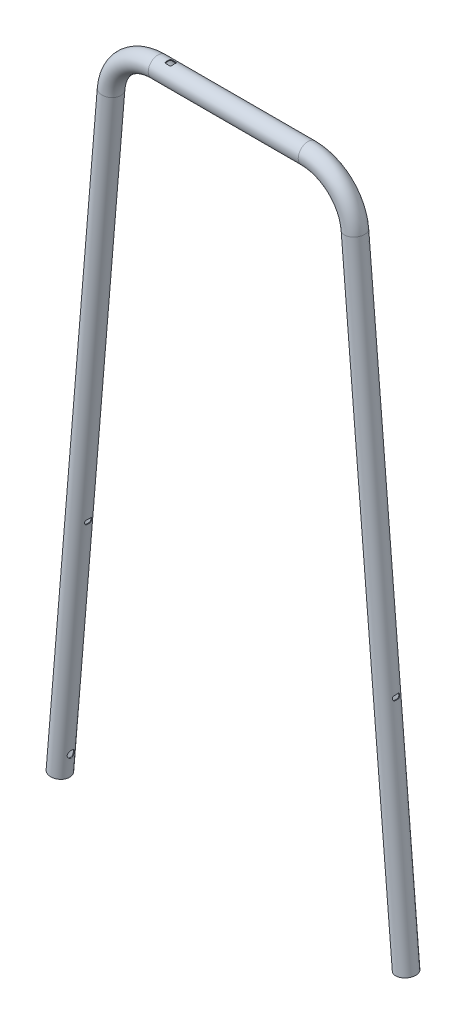
from build123d import *

# Parameters (mm, degrees)
SKETCH2_R           = 11
SKETCH2_R_2         = 10.2
SKETCH17_R          = 4
CUT_EXTRUDE6_DEPTH  = 50
CUT_EXTRUDE7_DEPTH  = 50
SKETCH19_R          = 4
CUT_EXTRUDE8_DEPTH  = 50
SKETCH20_R          = 3.5
CUT_EXTRUDE9_DEPTH  = 50
CUT_EXTRUDE10_DEPTH = 10


with BuildPart() as part:
    # Sweep2: sweep along a path in Sketch1
    with BuildLine(Plane.XY) as sweep2_path:
        Line((194.85, -162.284032228), (137.233830876, 531.10480277))
        ThreePointArc((137.233830876, 531.10480277), (120.307304917, 565.713456504), (84.415859244, 579.715967772))
        Line((84.415859244, 579.715967772), (-84.415859244, 579.715967772))
        ThreePointArc((-84.415859244, 579.715967772), (-120.307304917, 565.713456504), (-137.233830876, 531.10480277))
        Line((-137.233830876, 531.10480277), (-194.85, -162.284032228))
    # Sketch2 → Sweep2 (sweep)
    with BuildSketch(Plane(origin=(-194.85, -162.284032228, 0), x_dir=(-0.9965655024977618, 0.08280820751220104, 0), z_dir=(-0.08280820751220103, -0.9965655024977617, 0))):
        Circle(SKETCH2_R)
        Circle(SKETCH2_R_2, mode=Mode.SUBTRACT)
    sweep(path=sweep2_path.line)

    # Sketch17 → Cut-Extrude6 (cut)
    with BuildSketch(Plane(origin=(-194.85, -162.284032228, 0), x_dir=(0, 0, 1), z_dir=(-0.9965655024977617, 0.08280820751220212, 0))):
        with Locations((0, 23.8)):
            Circle(SKETCH17_R)
    cut_extrude6 = extrude(amount=-CUT_EXTRUDE6_DEPTH, mode=Mode.SUBTRACT)

    # Sketch18 → Cut-Extrude7 (cut, symmetric)
    with BuildSketch(Plane(origin=(-194.85, -162.284032228, 0), x_dir=(0, 0, 1), z_dir=(-0.9965655024977617, 0.08280820751220212, 0))):
        with BuildLine():
            Line((-2, 263.803489028), (2, 263.803489028))
            ThreePointArc((2, 263.803489028), (3.414213562, 263.21770259), (4, 261.803489028))
            Line((4, 261.803489028), (4, 260.803489028))
            ThreePointArc((4, 260.803489028), (3.414213562, 259.389275466), (2, 258.803489028))
            Line((2, 258.803489028), (-2, 258.803489028))
            ThreePointArc((-2, 258.803489028), (-3.414213562, 259.389275466), (-4, 260.803489028))
            Line((-4, 260.803489028), (-4, 261.803489028))
            ThreePointArc((-4, 261.803489028), (-3.414213562, 263.21770259), (-2, 263.803489028))
        make_face()
    cut_extrude7 = extrude(amount=CUT_EXTRUDE7_DEPTH, both=True, mode=Mode.SUBTRACT)

    # Mirror2: Cut-Extrude6, Cut-Extrude7 across plane
    add(cut_extrude6.mirror(Plane(origin=(0, 0, 0), x_dir=(0, 0, 1), z_dir=(1, 0, 0))), mode=Mode.SUBTRACT)
    add(cut_extrude7.mirror(Plane(origin=(0, 0, 0), x_dir=(0, 0, 1), z_dir=(1, 0, 0))), mode=Mode.SUBTRACT)

    # Sketch19 → Cut-Extrude8 (cut)
    with BuildSketch(Plane(origin=(-194.85, -162.284032228, 0), x_dir=(0, 0, 1), z_dir=(-0.9965655024977617, 0.08280820751220212, 0))):
        with Locations((0, 496.8)):
            Circle(SKETCH19_R)
    extrude(amount=CUT_EXTRUDE8_DEPTH, mode=Mode.SUBTRACT)

    # Sketch20 → Cut-Extrude9 (cut)
    with BuildSketch(Plane(origin=(0, 590.715967772, 0), x_dir=(1, 0, 0), z_dir=(0, 1, 0))):
        with Locations((-69.933830876, 0)):
            Circle(SKETCH20_R)
    extrude(amount=-CUT_EXTRUDE9_DEPTH, mode=Mode.SUBTRACT)

    # Sketch21 → Cut-Extrude10 (cut)
    with BuildSketch(Plane(origin=(0, 590.715967772, 0), x_dir=(1, 0, 0), z_dir=(0, 1, 0))):
        with BuildLine():
            Line((-72.433830876, -3.5), (-67.433830876, -3.5))
            ThreePointArc((-67.433830876, -3.5), (-66.726724095, -3.207106781), (-66.433830876, -2.5))
            Line((-66.433830876, -2.5), (-66.433830876, 2.5))
            ThreePointArc((-66.433830876, 2.5), (-66.726724095, 3.207106781), (-67.433830876, 3.5))
            Line((-67.433830876, 3.5), (-72.433830876, 3.5))
            ThreePointArc((-72.433830876, 3.5), (-73.140937657, 3.207106781), (-73.433830876, 2.5))
            Line((-73.433830876, 2.5), (-73.433830876, -2.5))
            ThreePointArc((-73.433830876, -2.5), (-73.140937657, -3.207106781), (-72.433830876, -3.5))
        make_face()
    extrude(amount=-CUT_EXTRUDE10_DEPTH, mode=Mode.SUBTRACT)


solid = part.part
